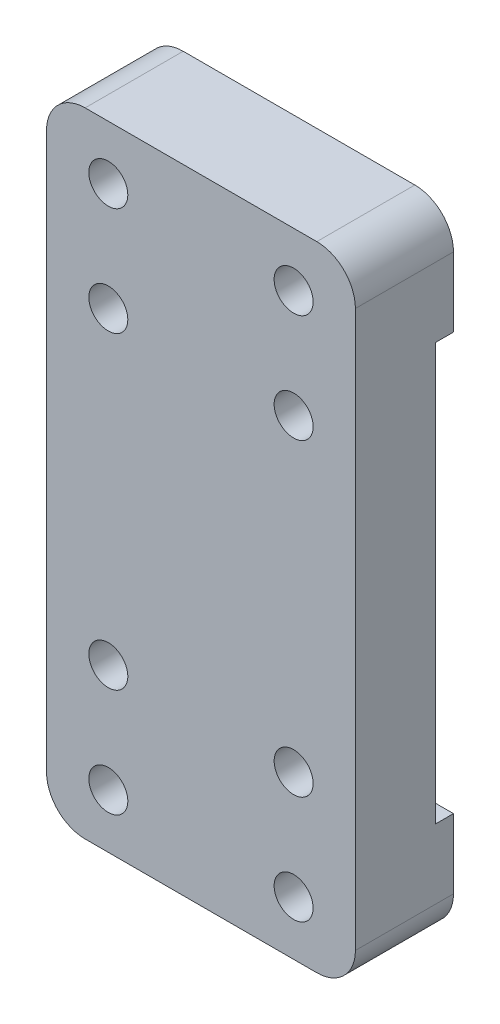
from build123d import *

# Parameters (mm, degrees)
SKETCH1_W           = 40
SKETCH1_H           = 82
SKETCH1_R           = 2.525
BOSS_EXTRUDE1_DEPTH = 12.7
SKETCH2_W           = 40
SKETCH2_H           = 54
CUT_EXTRUDE1_DEPTH  = 2.3
FILLET1_R           = 5


with BuildPart() as part:
    # Sketch1 → Boss-Extrude1 (new body)
    with BuildSketch(Plane.XY):
        Rectangle(SKETCH1_W, SKETCH1_H)
        with Locations((-12, 20)):
            Circle(SKETCH1_R, mode=Mode.SUBTRACT)
        with Locations((-12, 34)):
            Circle(SKETCH1_R, mode=Mode.SUBTRACT)
        with Locations(Location((12, 34, 0), (0, 0, 180))):
            Circle(SKETCH1_R, mode=Mode.SUBTRACT)
        with Locations(Location((12, 20, 0), (0, 0, 180))):
            Circle(SKETCH1_R, mode=Mode.SUBTRACT)
        with Locations((12, -20)):
            Circle(SKETCH1_R, mode=Mode.SUBTRACT)
        with Locations((12, -34)):
            Circle(SKETCH1_R, mode=Mode.SUBTRACT)
        with Locations(Location((-12, -20, 0), (0, 0, 180))):
            Circle(SKETCH1_R, mode=Mode.SUBTRACT)
        with Locations(Location((-12, -34, 0), (0, 0, 180))):
            Circle(SKETCH1_R, mode=Mode.SUBTRACT)
    extrude(amount=BOSS_EXTRUDE1_DEPTH)

    # Sketch2 → Cut-Extrude1 (cut)
    with BuildSketch(Plane(origin=(0, 0, 0), x_dir=(-1, 0, 0), z_dir=(0, 0, -1))):
        Rectangle(SKETCH2_W, SKETCH2_H)
    extrude(amount=-CUT_EXTRUDE1_DEPTH, mode=Mode.SUBTRACT)

    # Fillet1
    fillet1_edges = [part.edges().sort_by_distance(p)[0] for p in [
        (20, -41, 6.35),
        (-20, -41, 6.35),
        (-20, 41, 6.35),
        (20, 41, 6.35),
    ]]
    fillet(fillet1_edges, radius=FILLET1_R)


solid = part.part
